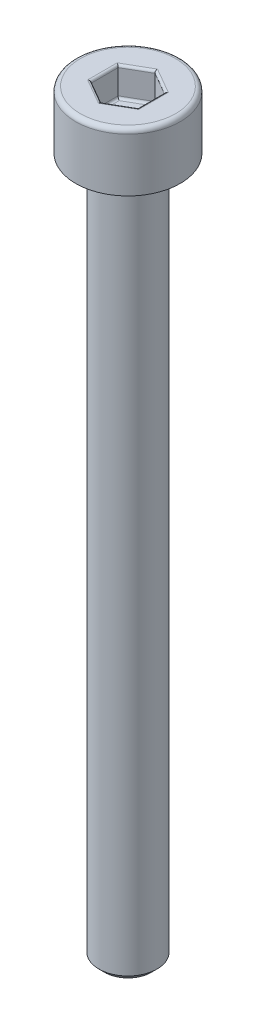
from build123d import *

# Parameters (mm, degrees)
CHAMFER1_SIZE      = 0.25
FILLET1_R          = 0.2
CUT_EXTRUDE1_DEPTH = 1.25
FILLET2_R          = 0.1


with BuildPart() as part:
    # Sketch1 → Revolve1 (revolve)
    with BuildSketch(Plane.XY, mode=Mode.PRIVATE) as revolve1_sk:
        Polygon((0, -32.5), (-1.25, -32.5), (-1.25, -2.5), (-2.25, -2.5), (-2.25, 0), (0, 0), align=None)
    revolve(revolve1_sk.sketch.rotate(Axis((0, 0, 0), (0, -1, 0)), 270), axis=Axis((0, 0, 0), (0, -1, 0)))

    # Chamfer1
    chamfer1_edges = [part.edges().sort_by_distance(p)[0] for p in [
        (0, -2.5, -1.25),
        (0, -32.5, -1.25),
    ]]
    chamfer(chamfer1_edges, length=CHAMFER1_SIZE)

    # Fillet1
    fillet1_edges = [part.edges().sort_by_distance(p)[0] for p in [
        (0, 0, -2.25),
    ]]
    fillet(fillet1_edges, radius=FILLET1_R)

    # Sketch2 → Cut-Extrude1 (cut)
    with BuildSketch(Plane(origin=(0, 0, 0), x_dir=(1, 0, 0), z_dir=(0, 1, 0))):
        Polygon((0, 1.154700538), (-1, 0.577350269), (-1, -0.577350269), (0, -1.154700538), (1, -0.577350269), (1, 0.577350269), align=None)
    extrude(amount=-CUT_EXTRUDE1_DEPTH, mode=Mode.SUBTRACT)

    # Fillet2
    fillet2_edges = [part.edges().sort_by_distance(p)[0] for p in [
        (0.5, -1.25, -0.866025404),
        (1, -1.25, 0),
        (0.5, -1.25, 0.866025404),
        (-0.5, -1.25, 0.866025404),
        (-1, -1.25, 0),
        (-0.5, -1.25, -0.866025404),
        (0.4999999999999987, 0, -0.8660254037844397),
        (-0.5000000000000006, 0, -0.8660254037844395),
        (-1, 0, 0),
        (-0.5000000000000007, 0, 0.8660254037844379),
        (0.4999999999999988, 0, 0.8660254037844382),
        (1, 0, 0),
    ]]
    fillet(fillet2_edges, radius=FILLET2_R)


solid = part.part
